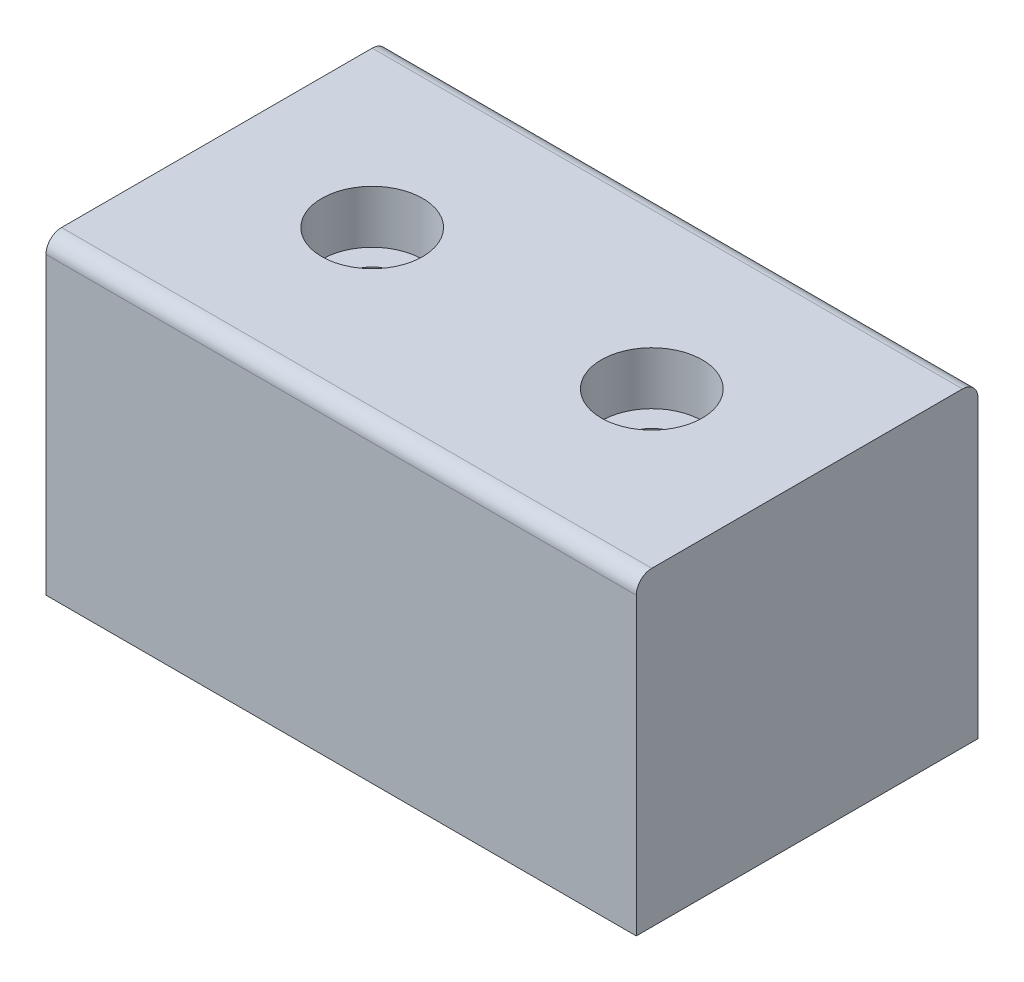
from build123d import *

# Parameters (mm, degrees)
ESQUISSE2_W                                        = 38
ESQUISSE2_H                                        = 22
BOSS_EXTRU_1_DEPTH                                 = 20
CHAMBRAGE_POUR_VIS_T_TE_HEXAGONALE_M31_D           = 3.4
CHAMBRAGE_POUR_VIS_T_TE_HEXAGONALE_M31_CBORE_D     = 6.5
CHAMBRAGE_POUR_VIS_T_TE_HEXAGONALE_M31_CBORE_DEPTH = 3.4
CONG_1_R                                           = 1


with BuildPart() as part:
    # Esquisse2 → Boss.-Extru.1 (new body)
    with BuildSketch(Plane(origin=(0, 0, 0), x_dir=(1, 0, 0), z_dir=(0, 1, 0))):
        Rectangle(ESQUISSE2_W, ESQUISSE2_H)
    extrude(amount=BOSS_EXTRU_1_DEPTH)

    # Chambrage pour vis à tête hexagonale M31 (through all)
    with Locations(Plane(origin=(0, 20, 0), x_dir=(1, 0, 0), z_dir=(0, 1, 0))):
        with Locations((-9, 0), (9, 0)):
            CounterBoreHole(CHAMBRAGE_POUR_VIS_T_TE_HEXAGONALE_M31_D / 2, CHAMBRAGE_POUR_VIS_T_TE_HEXAGONALE_M31_CBORE_D / 2, CHAMBRAGE_POUR_VIS_T_TE_HEXAGONALE_M31_CBORE_DEPTH)

    # Congé1
    cong_1_edges = [part.edges().sort_by_distance(p)[0] for p in [
        (0, 20, -11),
        (0, 20, 11),
    ]]
    fillet(cong_1_edges, radius=CONG_1_R)


solid = part.part
